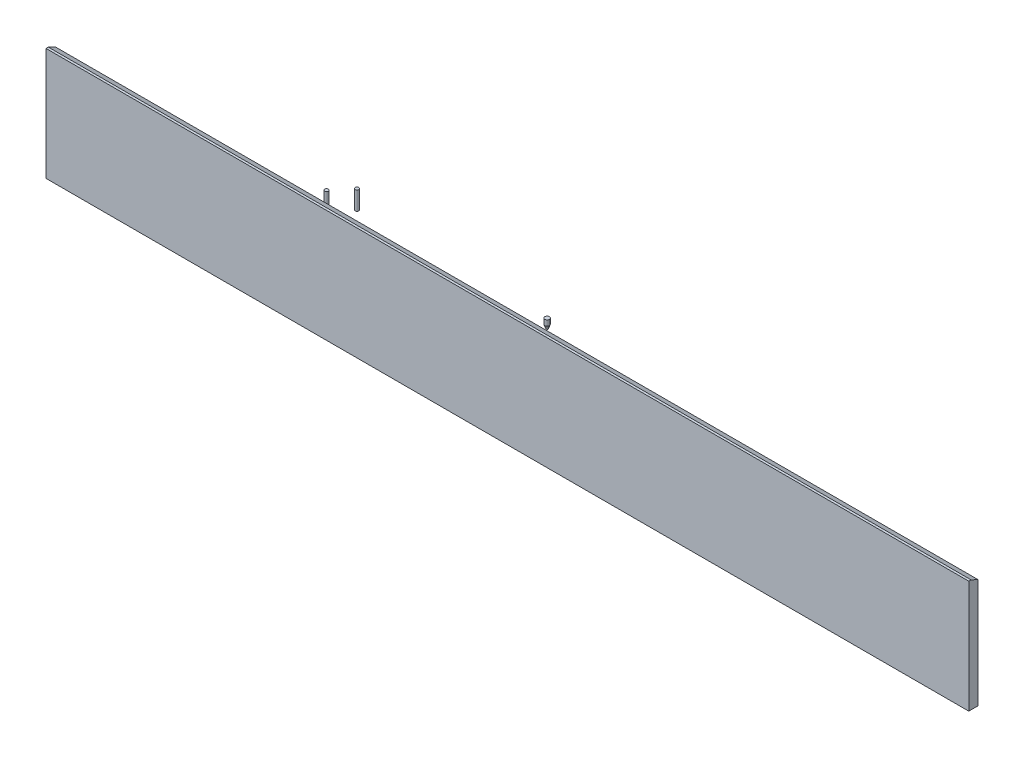
from build123d import *

# Parameters (mm, degrees)
SKETCH1_W                 = 1000
SKETCH1_H                 = 122
BOARD_DEPTH               = 10
BOARD_CHAMFER_SIZE        = 3.5
BOARD_CHAMFER_SIZE2       = 7.505774222
DYNAFIT_START             = 26.5
SKETCH2_R                 = 2.5
DYNAFIT_DEPTH             = 10
DYNAFIT_2_DEPTH           = 10
DYNAFIT_PIN_CHAMFER_SIZE  = 1.5
DYNAFIT_PIN_CHAMFER_SIZE2 = 4.121216129
SKETCH5_R                 = 2
RISER_DEPTH               = 10


with BuildPart() as part:
    # Sketch1 → Board (new body)
    with BuildSketch(Plane.XY):
        Rectangle(SKETCH1_W, SKETCH1_H)
    extrude(amount=BOARD_DEPTH)

    # Board chamfer
    board_chamfer_edges = [part.edges().sort_by_distance(p)[0] for p in [
        (0, 61, 0),
    ]]
    board_chamfer_side = [part.faces().sort_by_distance(p)[0] for p in [
        (0, 0, 0),
    ]]
    chamfer(board_chamfer_edges, length=BOARD_CHAMFER_SIZE, length2=BOARD_CHAMFER_SIZE2, reference=board_chamfer_side[0])

    # Sketch5 → Riser (add, symmetric)
    with BuildSketch(Plane(origin=(0, 0, 0), x_dir=(1, 0, 0), z_dir=(0, 1, 0))):
        with Locations(Location((-266, 60, 0), (0, 0, 270))):
            Circle(SKETCH5_R)
        with Locations(Location((-251, 78, 0), (0, 0, 270))):
            Circle(SKETCH5_R)
        with BuildLine():
            Line((-276, 14), (-221, 14))
            Line((-221, 14), (-221, 16))
            ThreePointArc((-221, 16), (-219, 18), (-217, 16))
            Line((-217, 16), (-217, 14))
            Line((-217, 14), (-191, 14))
            Line((-191, 14), (-191, 16))
            ThreePointArc((-191, 16), (-189, 18), (-187, 16))
            Line((-187, 16), (-187, 14))
            Line((-187, 14), (-156, 14))
            Line((-156, 14), (-156, 0))
            Line((-156, 0), (-276, 0))
            Line((-276, 0), (-276, 14))
        make_face()
    extrude(amount=RISER_DEPTH, both=True)


with BuildPart() as body_2:
    # Sketch2 → Dynafit (new body)
    with BuildSketch(Plane(origin=(0, 0, 0), x_dir=(1, 0, 0), z_dir=(0, 1, 0)).offset(DYNAFIT_START)):
        with Locations(Location((0, 33, 0), (0, 0, 270))):
            Circle(SKETCH2_R)
    extrude(amount=DYNAFIT_DEPTH)

    # Dynafit pin chamfer
    dynafit_pin_chamfer_edges = [body_2.edges().sort_by_distance(p)[0] for p in [
        (0, 26.5, -35.5),
    ]]
    dynafit_pin_chamfer_side = [body_2.faces().sort_by_distance(p)[0] for p in [
        (0, 26.5, -33),
    ]]
    chamfer(dynafit_pin_chamfer_edges, length=DYNAFIT_PIN_CHAMFER_SIZE, length2=DYNAFIT_PIN_CHAMFER_SIZE2, reference=dynafit_pin_chamfer_side[0])


with BuildPart() as body_3:
    # Sketch2 → Dynafit 2 (new body)
    with BuildSketch(Plane(origin=(0, 0, 0), x_dir=(1, 0, 0), z_dir=(0, 1, 0)).offset(DYNAFIT_START)):
        with Locations(Location((-22, 10, 0), (0, 0, 270))):
            Circle(SKETCH2_R)
    extrude(amount=DYNAFIT_2_DEPTH)


with BuildPart() as riser_piece_1:
    # of the separate pieces the step leaves, piece 1, a body of its own (riser_pieces)
    add(part.part.solids().sort_by_distance((500, 61, 7.505774222))[0])


with BuildPart() as riser_piece_2:
    # of the separate pieces the step leaves, piece 2, a body of its own (riser_pieces)
    add(part.part.solids().sort_by_distance((-266, -10, -58))[0])


with BuildPart() as riser_piece_3:
    # of the separate pieces the step leaves, piece 3, a body of its own (riser_pieces)
    add(part.part.solids().sort_by_distance((-251, -10, -76))[0])


solid = Compound([body_2.part, body_3.part, riser_piece_1.part, riser_piece_2.part, riser_piece_3.part])
